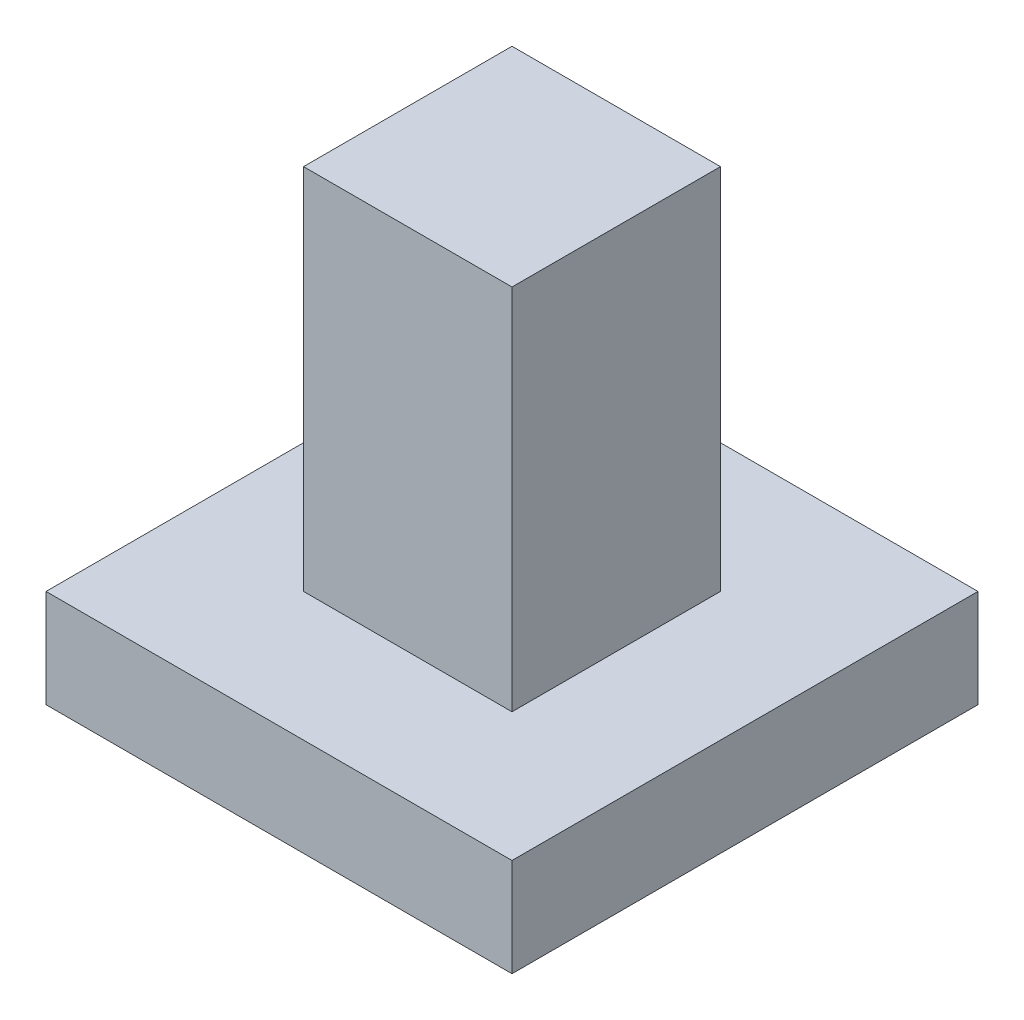
from build123d import *

# Parameters (mm, degrees)
SKETCH_1_W      = 7.6
SKETCH_1_H      = 7.6
EXTRUDE_1_DEPTH = 1.6
SKETCH_2_W      = 3.4
SKETCH_2_H      = 3.4
EXTRUDE_2_DEPTH = 6


with BuildPart() as part:
    # 草图1 → 凸台-拉伸1 (new body)
    with BuildSketch(Plane(origin=(0, 0, 0), x_dir=(1, 0, 0), z_dir=(0, 1, 0))):
        with Locations((-3.8, 3.8)):
            Rectangle(SKETCH_1_W, SKETCH_1_H)
    extrude(amount=EXTRUDE_1_DEPTH)

    # 草图2 → 凸台-拉伸2 (add)
    with BuildSketch(Plane(origin=(0, 1.6, 0), x_dir=(1, 0, 0), z_dir=(0, 1, 0))):
        with Locations((-3.8, 3.8)):
            Rectangle(SKETCH_2_W, SKETCH_2_H)
    extrude(amount=EXTRUDE_2_DEPTH)


solid = part.part
